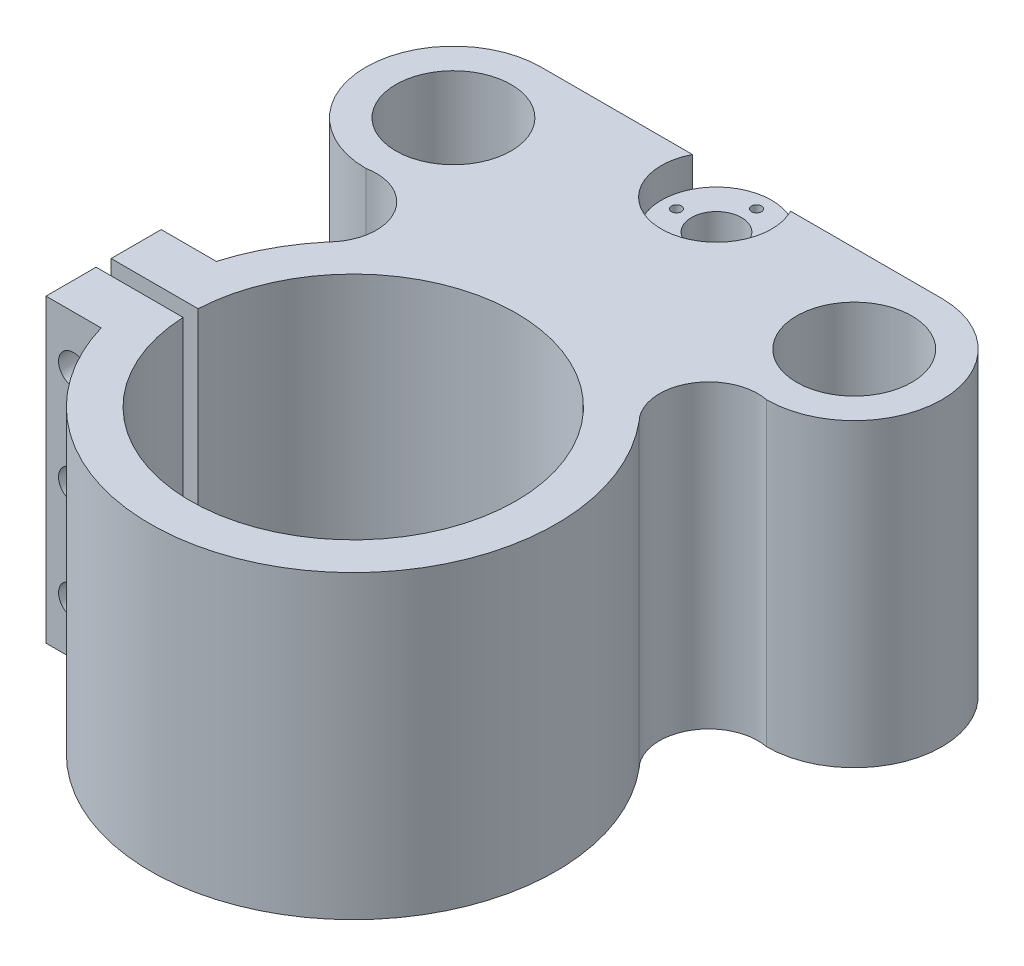
from build123d import *

# Parameters (mm, degrees)
SKETCH1_R                      = 11.5
BOSS_EXTRUDE1_DEPTH            = 60
CUT_EXTRUDE1_REACH             = 167.294
SKETCH2_R                      = 3
CUT_EXTRUDE1_DIRECTION_2_DEPTH = 166.294105853
SKETCH3_W                      = 11
SKETCH3_H                      = 10
CUT_EXTRUDE2_DEPTH             = 5
SKETCH5_R                      = 11
BOSS_EXTRUDE2_DEPTH            = 60
SKETCH5_12_R                   = 11
CUT_EXTRUDE7_DEPTH             = 6
SKETCH5_13_R                   = 5
CUT_EXTRUDE8_DEPTH             = 189.480626049
CUT_EXTRUDE9_START             = -6
SKETCH5_14_R                   = 1
CUT_EXTRUDE9_DEPTH             = 6


with BuildPart() as part:
    # Sketch1 → Boss-Extrude1 (new body)
    with BuildSketch(Plane(origin=(0, 0, 0), x_dir=(1, 0, 0), z_dir=(0, 1, 0))):
        with BuildLine():
            Line((17.257858547, 56.070568137), (17.257858547, 46.070568137))
            Line((17.257858547, 46.070568137), (34.625468063, 46.070568137))
            ThreePointArc((34.625468063, 46.070568137), (99.590834225, 44.570568137), (34.625468063, 43.070568137))
            Line((34.625468063, 43.070568137), (17.257858547, 43.070568137))
            Line((17.257858547, 43.070568137), (17.257858547, 33.070568137))
            Line((17.257858547, 33.070568137), (28.257858547, 33.070568137))
            ThreePointArc((28.257858547, 33.070568137), (86.245043845, 8.88631035), (98.136101416, 70.579054926))
            ThreePointArc((98.136101416, 70.579054926), (96.534674627, 82.125537677), (107.090834225, 87.070568137))
            ThreePointArc((107.090834225, 87.070568137), (124.590834225, 104.570568137), (107.090834225, 122.070568137))
            Line((107.090834225, 122.070568137), (27.090834225, 122.070568137))
            ThreePointArc((27.090834225, 122.070568137), (9.590834225, 104.570568137), (27.090834225, 87.070568137))
            ThreePointArc((27.090834225, 87.070568137), (37.646993822, 82.125537677), (36.045567034, 70.579054926))
            ThreePointArc((36.045567034, 70.579054926), (31.406576437, 63.724777757), (28.257858547, 56.070568137))
            Line((28.257858547, 56.070568137), (17.257858547, 56.070568137))
        make_face()
        with Locations(Location((27.090834225, 104.570568137, 0), (0, 0, 270))):
            Circle(SKETCH1_R, mode=Mode.SUBTRACT)
        with Locations(Location((107.090834225, 104.570568137, 0), (0, 0, 270))):
            Circle(SKETCH1_R, mode=Mode.SUBTRACT)
    extrude(amount=BOSS_EXTRUDE1_DEPTH)

    # Cut-Extrude1: up to this face of the body (flat: up to its plane)
    cut_extrude1_end = Plane(part.part.faces().sort_by_distance((22.757858547, 30, -56.070568137))[0])
    # Sketch2 → Cut-Extrude1 (cut, up to the picked face)
    with BuildSketch(Plane(origin=(-1.111756956, 0, -33.070568137), x_dir=(1, 0, 0), z_dir=(0, 0, 1)), mode=Mode.PRIVATE) as cut_extrude1_sk1:
        with Locations(Location((23.869615503, 30, 0), (0, 0, 180))):
            Circle(SKETCH2_R)
    cut_extrude1_tool1 = split(extrude(cut_extrude1_sk1.sketch, amount=-CUT_EXTRUDE1_REACH, mode=Mode.PRIVATE), bisect_by=cut_extrude1_end, keep=Keep.BOTH, mode=Mode.PRIVATE)
    # Sketch2 → Cut-Extrude1 (cut, up to the picked face)
    with BuildSketch(Plane(origin=(-1.111756956, 0, -33.070568137), x_dir=(1, 0, 0), z_dir=(0, 0, 1)), mode=Mode.PRIVATE) as cut_extrude1_sk2:
        with Locations(Location((23.869615503, 50, 0), (0, 0, 180))):
            Circle(SKETCH2_R)
    cut_extrude1_tool2 = split(extrude(cut_extrude1_sk2.sketch, amount=-CUT_EXTRUDE1_REACH, mode=Mode.PRIVATE), bisect_by=cut_extrude1_end, keep=Keep.BOTH, mode=Mode.PRIVATE)
    # Sketch2 → Cut-Extrude1 (cut, up to the picked face)
    with BuildSketch(Plane(origin=(-1.111756956, 0, -33.070568137), x_dir=(1, 0, 0), z_dir=(0, 0, 1)), mode=Mode.PRIVATE) as cut_extrude1_sk3:
        with Locations(Location((23.869615503, 10, 0), (0, 0, 180))):
            Circle(SKETCH2_R)
    cut_extrude1_tool3 = split(extrude(cut_extrude1_sk3.sketch, amount=-CUT_EXTRUDE1_REACH, mode=Mode.PRIVATE), bisect_by=cut_extrude1_end, keep=Keep.BOTH, mode=Mode.PRIVATE)
    add(cut_extrude1_tool1.solids().sort_by(Axis((22.757859, 30, -33.070568), (0, 0, -1)))[0], mode=Mode.SUBTRACT)
    add(cut_extrude1_tool2.solids().sort_by(Axis((22.757859, 50, -33.070568), (0, 0, -1)))[0], mode=Mode.SUBTRACT)
    add(cut_extrude1_tool3.solids().sort_by(Axis((22.757859, 10, -33.070568), (0, 0, -1)))[0], mode=Mode.SUBTRACT)

    # Sketch2 → Cut-Extrude1 direction 2 (cut)
    with BuildSketch(Plane(origin=(-1.111756956, 0, -33.070568137), x_dir=(1, 0, 0), z_dir=(0, 0, 1))):
        with Locations(Location((23.869615503, 30, 0), (0, 0, 180))):
            Circle(SKETCH2_R)
        with Locations(Location((23.869615503, 50, 0), (0, 0, 180))):
            Circle(SKETCH2_R)
        with Locations(Location((23.869615503, 10, 0), (0, 0, 180))):
            Circle(SKETCH2_R)
    extrude(amount=CUT_EXTRUDE1_DIRECTION_2_DEPTH, mode=Mode.SUBTRACT)

    # Sketch3 → Cut-Extrude2 (cut)
    with BuildSketch(Plane(origin=(0, 0, -56.070568137), x_dir=(-1, 0, 0), z_dir=(0, 0, -1))):
        with Locations((-22.757858547, 50)):
            Rectangle(SKETCH3_W, SKETCH3_H)
        with Locations((-22.757858547, 30)):
            Rectangle(SKETCH3_W, SKETCH3_H)
        with Locations((-22.757858547, 10)):
            Rectangle(SKETCH3_W, SKETCH3_H)
    extrude(amount=-CUT_EXTRUDE2_DEPTH, mode=Mode.SUBTRACT)

    # Sketch5 → Boss-Extrude2 (add)
    with BuildSketch(Plane(origin=(0, 60, 0), x_dir=(1, 0, 0), z_dir=(0, 1, 0))):
        with Locations((67.090834225, 117.070568137)):
            Circle(SKETCH5_R)
    extrude(amount=-BOSS_EXTRUDE2_DEPTH)

    # Sketch5<12> → Cut-Extrude7 (cut)
    with BuildSketch(Plane(origin=(0, 60, 0), x_dir=(1, 0, 0), z_dir=(0, 1, 0))):
        with Locations((67.090834225, 117.070568137)):
            Circle(SKETCH5_12_R)
    extrude(amount=-CUT_EXTRUDE7_DEPTH, mode=Mode.SUBTRACT)

    # Sketch5<13> → Cut-Extrude8 (cut, through all)
    with BuildSketch(Plane(origin=(0, 60, 0), x_dir=(1, 0, 0), z_dir=(0, 1, 0))):
        with Locations(Location((67.090834225, 117.070568137, 0), (0, 0, 270))):
            Circle(SKETCH5_13_R)
    extrude(amount=-CUT_EXTRUDE8_DEPTH, mode=Mode.SUBTRACT)

    # Sketch5<14> → Cut-Extrude9 (cut)
    with BuildSketch(Plane(origin=(0, 60, 0), x_dir=(1, 0, 0), z_dir=(0, 1, 0)).offset(CUT_EXTRUDE9_START)):
        with Locations(Location((67.090834225, 125.070568137, 0), (0, 0, 270))):
            Circle(SKETCH5_14_R)
        with Locations(Location((75.090834225, 117.070568137, 0), (0, 0, 270))):
            Circle(SKETCH5_14_R)
        with Locations(Location((67.090834225, 109.070568137, 0), (0, 0, 270))):
            Circle(SKETCH5_14_R)
        with Locations(Location((59.090834225, 117.070568137, 0), (0, 0, 270))):
            Circle(SKETCH5_14_R)
    extrude(amount=-CUT_EXTRUDE9_DEPTH, mode=Mode.SUBTRACT)


solid = part.part
